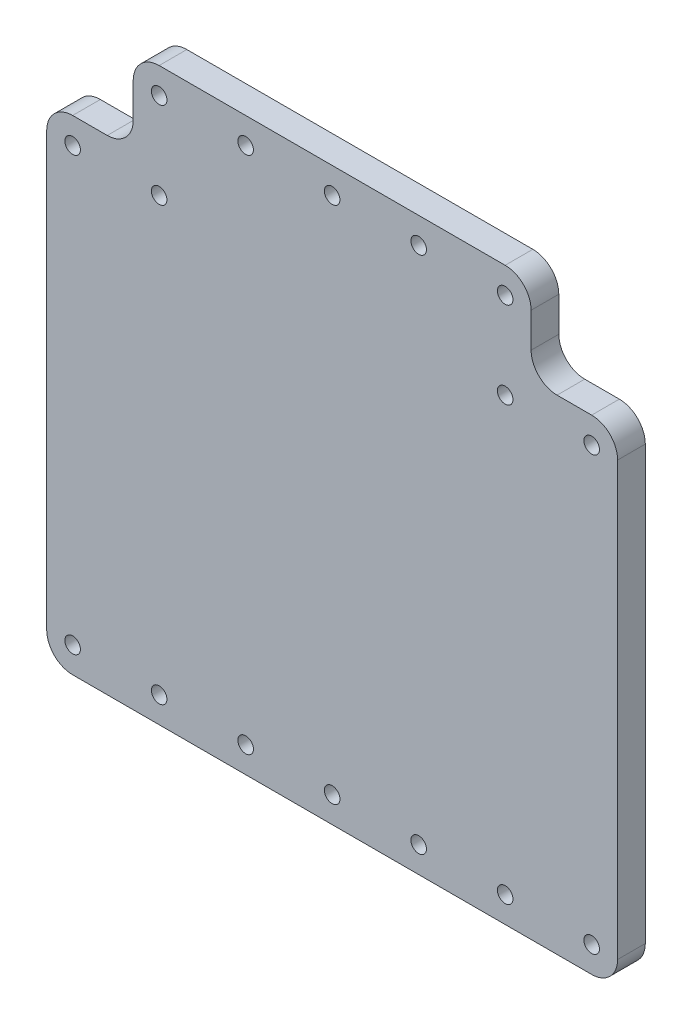
from build123d import *

# Parameters (mm, degrees)
BOSS_EXTRUDE1_DEPTH            = 8
CBORE_FOR_M4_SHCS1_D           = 4.5
CBORE_FOR_M4_SHCS1_CBORE_D     = 8
CBORE_FOR_M4_SHCS1_CBORE_DEPTH = 4


with BuildPart() as part:
    # Sketch2 → Boss-Extrude1 (new body)
    with BuildSketch(Plane.XY):
        with BuildLine():
            Line((-57.5, 60), (-57.5, 50))
            ThreePointArc((-57.5, 50), (-59.696699141, 44.696699141), (-65, 42.5))
            Line((-65, 42.5), (-75, 42.5))
            ThreePointArc((-75, 42.5), (-80.303300859, 40.303300859), (-82.5, 35))
            Line((-82.5, 35), (-82.5, -90))
            ThreePointArc((-82.5, -90), (-80.303300859, -95.303300859), (-75, -97.5))
            Line((-75, -97.5), (75, -97.5))
            ThreePointArc((75, -97.5), (80.303300859, -95.303300859), (82.5, -90))
            Line((82.5, -90), (82.5, 35))
            ThreePointArc((82.5, 35), (80.303300859, 40.303300859), (75, 42.5))
            Line((75, 42.5), (65, 42.5))
            ThreePointArc((65, 42.5), (59.696699141, 44.696699141), (57.5, 50))
            Line((57.5, 50), (57.5, 60))
            ThreePointArc((57.5, 60), (55.303300859, 65.303300859), (50, 67.5))
            Line((50, 67.5), (-50, 67.5))
            ThreePointArc((-50, 67.5), (-55.303300859, 65.303300859), (-57.5, 60))
        make_face()
    extrude(amount=-BOSS_EXTRUDE1_DEPTH)

    # CBORE for M4 SHCS1 (through all)
    with Locations(Plane(origin=(0, 0, -8), x_dir=(-1, 0, 0), z_dir=(0, 0, -1))):
        with Locations((-75, 35), (-50, 35), (-50, 60), (-25, 60), (0, 60), (25, 60), (50, 60), (50, 35), (75, 35), (-75, -90), (-50, -90), (-25, -90), (0, -90), (25, -90), (50, -90), (75, -90)):
            CounterBoreHole(CBORE_FOR_M4_SHCS1_D / 2, CBORE_FOR_M4_SHCS1_CBORE_D / 2, CBORE_FOR_M4_SHCS1_CBORE_DEPTH)


solid = part.part
